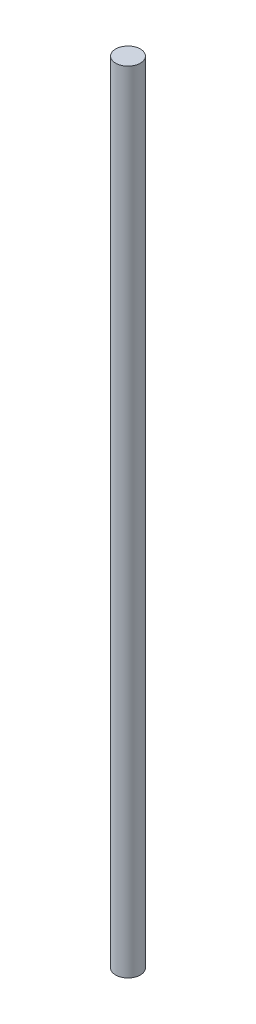
from build123d import *

# Parameters (mm, degrees)
SKETCH1_R           = 6.35
BOSS_EXTRUDE1_DEPTH = 406.4


with BuildPart() as part:
    # Sketch1 → Boss-Extrude1 (new body)
    with BuildSketch(Plane(origin=(0, 0, 0), x_dir=(1, 0, 0), z_dir=(0, 1, 0))):
        with Locations(Location((0, 0, 0), (0, 0, 270))):
            Circle(SKETCH1_R)
    extrude(amount=BOSS_EXTRUDE1_DEPTH)


solid = part.part
